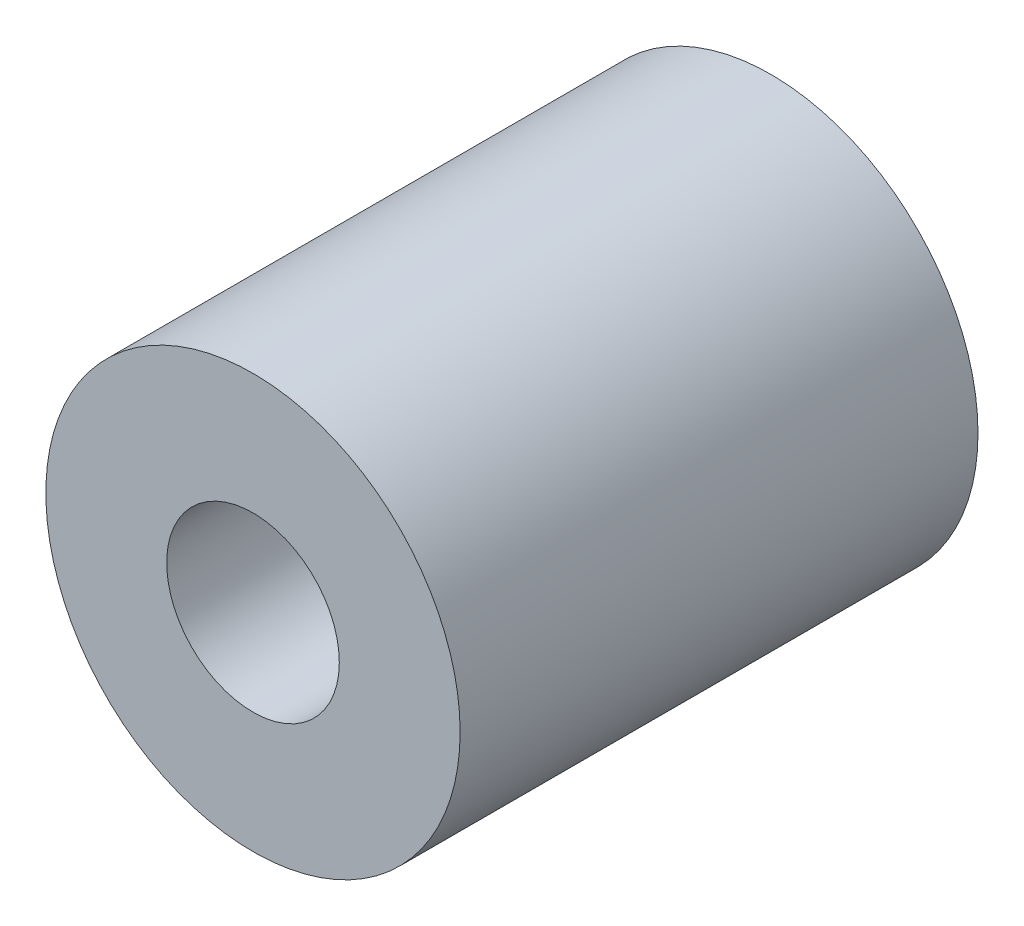
from build123d import *

# Parameters (mm, degrees)
SKETCH1_R           = 12
SKETCH1_R_2         = 5
BOSS_EXTRUDE1_DEPTH = 30


with BuildPart() as part:
    # Sketch1 → Boss-Extrude1 (new body)
    with BuildSketch(Plane.XY):
        Circle(SKETCH1_R)
        Circle(SKETCH1_R_2, mode=Mode.SUBTRACT)
    extrude(amount=BOSS_EXTRUDE1_DEPTH)


solid = part.part
